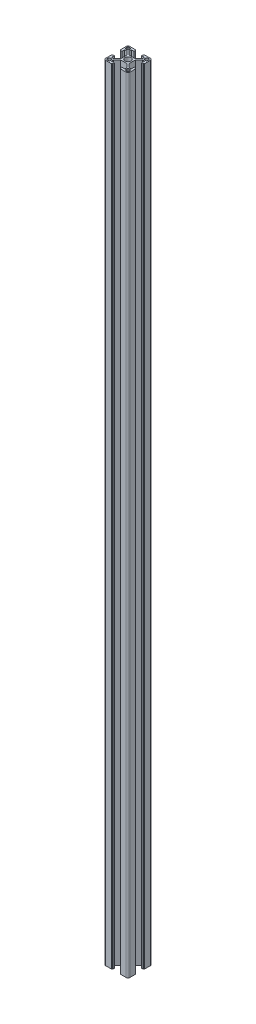
from build123d import *

# Parameters (mm, degrees)
SKETCH_1_R      = 2.5
EXTRUDE_1_DEPTH = 650


with BuildPart() as part:
    # 草图1 → 凸台-拉伸1 (new body)
    with BuildSketch(Plane(origin=(0, 0, 0), x_dir=(1, 0, 0), z_dir=(0, 1, 0))):
        with BuildLine():
            Line((-3.6, 10), (-8.5, 10))
            ThreePointArc((-8.5, 10), (-9.560660172, 9.560660172), (-10, 8.5))
            Line((-10, 8.5), (-10, 3.6))
            Line((-10, 3.6), (-9.4, 3.6))
            Line((-9.4, 3.6), (-9.4, 3.1))
            Line((-9.4, 3.1), (-8.2, 3.1))
            Line((-8.2, 3.1), (-8.2, 5.5))
            Line((-8.2, 5.5), (-6.348528137, 5.5))
            Line((-6.348528137, 5.5), (-3.5, 2.651471863))
            Line((-3.5, 2.651471863), (-3.5, -2.651471863))
            Line((-3.5, -2.651471863), (-6.348528137, -5.5))
            Line((-6.348528137, -5.5), (-8.2, -5.5))
            Line((-8.2, -5.5), (-8.2, -3.1))
            Line((-8.2, -3.1), (-9.4, -3.1))
            Line((-9.4, -3.1), (-9.4, -3.6))
            Line((-9.4, -3.6), (-10, -3.6))
            Line((-10, -3.6), (-10, -8.5))
            ThreePointArc((-10, -8.5), (-9.560660172, -9.560660172), (-8.5, -10))
            Line((-8.5, -10), (-3.6, -10))
            Line((-3.6, -10), (-3.6, -9.4))
            Line((-3.6, -9.4), (-3.1, -9.4))
            Line((-3.1, -9.4), (-3.1, -8.2))
            Line((-3.1, -8.2), (-5.5, -8.2))
            Line((-5.5, -8.2), (-5.5, -6.348528137))
            Line((-5.5, -6.348528137), (-2.651471863, -3.5))
            Line((-2.651471863, -3.5), (2.651471863, -3.5))
            Line((2.651471863, -3.5), (5.5, -6.348528137))
            Line((5.5, -6.348528137), (5.5, -8.2))
            Line((5.5, -8.2), (3.1, -8.2))
            Line((3.1, -8.2), (3.1, -9.4))
            Line((3.1, -9.4), (3.6, -9.4))
            Line((3.6, -9.4), (3.6, -10))
            Line((3.6, -10), (8.5, -10))
            ThreePointArc((8.5, -10), (9.560660172, -9.560660172), (10, -8.5))
            Line((10, -8.5), (10, -3.6))
            Line((10, -3.6), (9.4, -3.6))
            Line((9.4, -3.6), (9.4, -3.1))
            Line((9.4, -3.1), (8.2, -3.1))
            Line((8.2, -3.1), (8.2, -5.5))
            Line((8.2, -5.5), (6.348528137, -5.5))
            Line((6.348528137, -5.5), (3.5, -2.651471863))
            Line((3.5, -2.651471863), (3.5, 2.651471863))
            Line((3.5, 2.651471863), (6.348528137, 5.5))
            Line((6.348528137, 5.5), (8.2, 5.5))
            Line((8.2, 5.5), (8.2, 3.1))
            Line((8.2, 3.1), (9.4, 3.1))
            Line((9.4, 3.1), (9.4, 3.6))
            Line((9.4, 3.6), (10, 3.6))
            Line((10, 3.6), (10, 8.5))
            ThreePointArc((10, 8.5), (9.560660172, 9.560660172), (8.5, 10))
            Line((8.5, 10), (3.6, 10))
            Line((3.6, 10), (3.6, 9.4))
            Line((3.6, 9.4), (3.1, 9.4))
            Line((3.1, 9.4), (3.1, 8.2))
            Line((3.1, 8.2), (5.5, 8.2))
            Line((5.5, 8.2), (5.5, 6.348528137))
            Line((5.5, 6.348528137), (2.651471863, 3.5))
            Line((2.651471863, 3.5), (-2.651471863, 3.5))
            Line((-2.651471863, 3.5), (-5.5, 6.348528137))
            Line((-5.5, 6.348528137), (-5.5, 8.2))
            Line((-5.5, 8.2), (-3.1, 8.2))
            Line((-3.1, 8.2), (-3.1, 9.4))
            Line((-3.1, 9.4), (-3.6, 9.4))
            Line((-3.6, 9.4), (-3.6, 10))
        make_face()
        with Locations(Location((0, 0, 0), (0, 0, 270))):
            Circle(SKETCH_1_R, mode=Mode.SUBTRACT)
        with BuildLine():
            Line((-7.4, 9.1), (-8.1, 9.1))
            ThreePointArc((-8.1, 9.1), (-8.807106781, 8.807106781), (-9.1, 8.1))
            Line((-9.1, 8.1), (-9.1, 7.4))
            ThreePointArc((-9.1, 7.4), (-8.807106781, 6.692893219), (-8.1, 6.4))
            Line((-8.1, 6.4), (-7.4, 6.4))
            ThreePointArc((-7.4, 6.4), (-6.692893219, 6.692893219), (-6.4, 7.4))
            Line((-6.4, 7.4), (-6.4, 8.1))
            ThreePointArc((-6.4, 8.1), (-6.692893219, 8.807106781), (-7.4, 9.1))
        make_face(mode=Mode.SUBTRACT)
        with BuildLine():
            Line((9.1, 7.4), (9.1, 8.1))
            ThreePointArc((9.1, 8.1), (8.807106781, 8.807106781), (8.1, 9.1))
            Line((8.1, 9.1), (7.4, 9.1))
            ThreePointArc((7.4, 9.1), (6.692893219, 8.807106781), (6.4, 8.1))
            Line((6.4, 8.1), (6.4, 7.4))
            ThreePointArc((6.4, 7.4), (6.692893219, 6.692893219), (7.4, 6.4))
            Line((7.4, 6.4), (8.1, 6.4))
            ThreePointArc((8.1, 6.4), (8.807106781, 6.692893219), (9.1, 7.4))
        make_face(mode=Mode.SUBTRACT)
        with BuildLine():
            Line((7.4, -9.1), (8.1, -9.1))
            ThreePointArc((8.1, -9.1), (8.807106781, -8.807106781), (9.1, -8.1))
            Line((9.1, -8.1), (9.1, -7.4))
            ThreePointArc((9.1, -7.4), (8.807106781, -6.692893219), (8.1, -6.4))
            Line((8.1, -6.4), (7.4, -6.4))
            ThreePointArc((7.4, -6.4), (6.692893219, -6.692893219), (6.4, -7.4))
            Line((6.4, -7.4), (6.4, -8.1))
            ThreePointArc((6.4, -8.1), (6.692893219, -8.807106781), (7.4, -9.1))
        make_face(mode=Mode.SUBTRACT)
        with BuildLine():
            Line((-9.1, -7.4), (-9.1, -8.1))
            ThreePointArc((-9.1, -8.1), (-8.807106781, -8.807106781), (-8.1, -9.1))
            Line((-8.1, -9.1), (-7.4, -9.1))
            ThreePointArc((-7.4, -9.1), (-6.692893219, -8.807106781), (-6.4, -8.1))
            Line((-6.4, -8.1), (-6.4, -7.4))
            ThreePointArc((-6.4, -7.4), (-6.692893219, -6.692893219), (-7.4, -6.4))
            Line((-7.4, -6.4), (-8.1, -6.4))
            ThreePointArc((-8.1, -6.4), (-8.807106781, -6.692893219), (-9.1, -7.4))
        make_face(mode=Mode.SUBTRACT)
    extrude(amount=EXTRUDE_1_DEPTH)


solid = part.part
